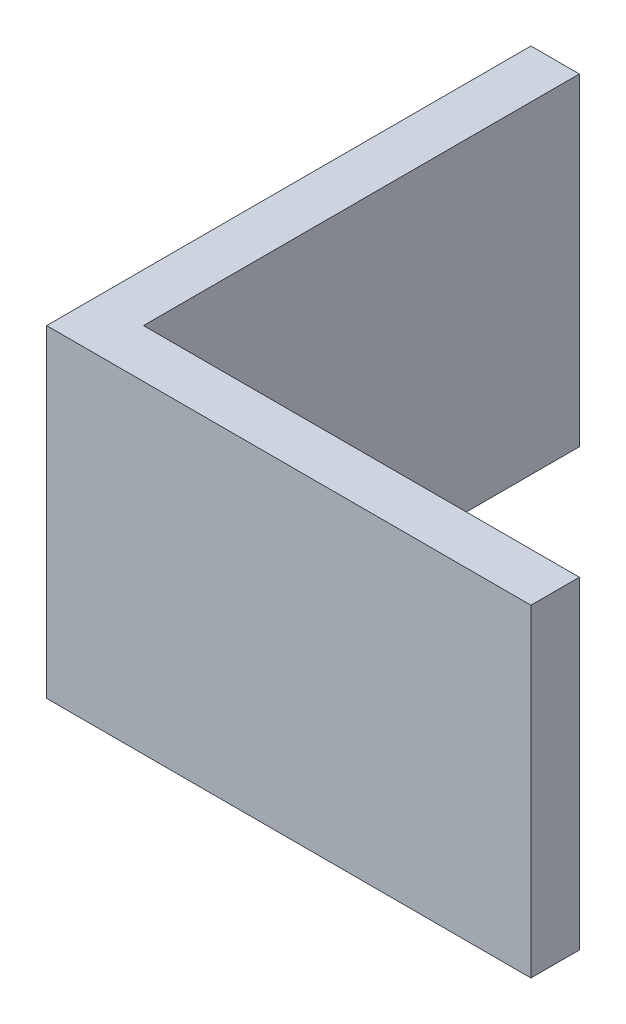
from build123d import *

# Parameters (mm, degrees)
BOSS_EXTRUDE1_DEPTH = 20


with BuildPart() as part:
    # Sketch2 → Boss-Extrude1 (new body)
    with BuildSketch(Plane(origin=(0, 0, 0), x_dir=(1, 0, 0), z_dir=(0, 1, 0))):
        Polygon((0, 0), (0, -30), (30, -30), (30, -27), (3, -27), (3, 0), align=None)
    extrude(amount=BOSS_EXTRUDE1_DEPTH)


solid = part.part
